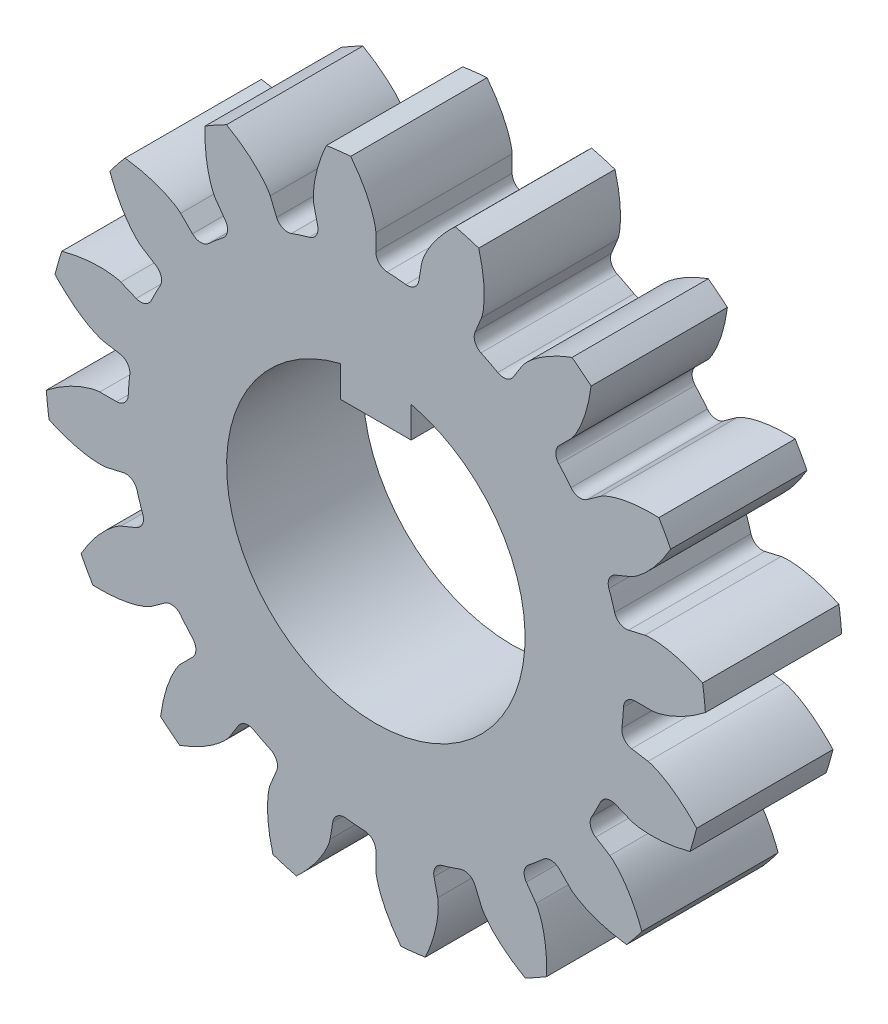
from build123d import *

# Parameters (mm, degrees)
SKETCH1_R                 = 14.0625
BOSS_EXTRUDE1_DEPTH       = 5.8
CUT_EXTRUDE1_DEPTH        = 21.715883097
FILLET1_R                 = 0.5
CIRPATTERN19_COUNT        = 16
FILLET1_OF_CIRPATTERN19_R = 0.5
CUT_EXTRUDE2_DEPTH        = 21.660632656


with BuildPart() as part:
    # Sketch1 → Boss-Extrude1 (new body)
    with BuildSketch(Plane.XY):
        Circle(SKETCH1_R)
    extrude(amount=BOSS_EXTRUDE1_DEPTH)

    # Sketch2 → Cut-Extrude1 (cut, symmetric)
    with BuildSketch(Plane.XY.offset(5.8)):
        with BuildLine():
            Line((11.74615776, 0), (10.546875, 0))
            ThreePointArc((10.546875, 0), (10.510330334, -0.877227761), (10.400949587, -1.748376376))
            Line((10.400949587, -1.748376376), (11.583639201, -1.947183856))
            add(Edge.make_bspline(
                [(11.583639201, -1.947183856), (11.587589537, -1.947906479), (11.598636798, -1.950109213), (11.619390143, -1.954967722), (11.653043024, -1.963876588), (11.695593212, -1.976665304), (11.750177743, -1.994836747), (11.813916551, -2.018345028), (11.88333315, -2.046369626), (11.958132634, -2.079207519), (12.032084113, -2.114033132), (12.105198467, -2.150683237), (12.177420437, -2.188907553), (12.264149408, -2.237221541), (12.367075196, -2.297943399), (12.485735253, -2.372938949), (12.618308241, -2.462709979), (12.751163332, -2.559177154), (12.879998288, -2.658169381), (13.007882145, -2.762795087), (13.129988288, -2.867287029), (13.25434815, -2.980451792), (13.36789046, -3.087271642), (13.490355119, -3.210085536), (13.563860971, -3.285459592), (13.622537428, -3.348356192), (13.650563847, -3.378759078)],
                knots=[0, 0, 0, 0, 0, 0.005376749, 0.015083688, 0.02853182, 0.04661014, 0.064854849, 0.092110525, 0.119476176, 0.146842496, 0.174208854, 0.201574956, 0.228941013, 0.256307345, 0.307035032, 0.361767352, 0.416499661, 0.471231937, 0.525964282, 0.580696616, 0.635428982, 0.690161387, 0.744893688, 0.799626082, 0.851029126, 0.851029126, 0.851029126, 0.851029126, 0.851029126], degree=4))
            ThreePointArc((13.650563847, -3.378759078), (13.959136083, -1.701888973), (14.0625, 0))
            ThreePointArc((14.0625, 0), (14.052321247, 0.534952164), (14.021799724, 1.069129907))
            add(Edge.make_bspline(
                [(11.74615776, 0), (11.750173229, 5.777e-05), (11.761432794, 0.000398701), (11.782704403, 0.001749664), (11.817368506, 0.004956563), (11.861449985, 0.010514708), (11.918291607, 0.019386146), (11.985045546, 0.032003061), (12.058147397, 0.048132586), (12.137355566, 0.068116479), (12.216056972, 0.090201166), (12.294235284, 0.114223872), (12.371794519, 0.139946941), (12.465332623, 0.173215229), (12.576900325, 0.216034734), (12.706350775, 0.270322141), (12.851971018, 0.336874222), (12.998979496, 0.409983036), (13.142442043, 0.486248391), (13.285900523, 0.568226947), (13.423639055, 0.651031372), (13.565037835, 0.742015019), (13.694716924, 0.828534788), (13.835846278, 0.929348233), (13.920830019, 0.99149421), (13.989121129, 1.043793667), (14.021799724, 1.069129907)],
                knots=[0, 0, 0, 0, 0, 0.005376749, 0.015083688, 0.02853182, 0.04661014, 0.064854849, 0.092110525, 0.119476176, 0.146842496, 0.174208854, 0.201574956, 0.228941013, 0.256307345, 0.307035032, 0.361767352, 0.416499661, 0.471231937, 0.525964282, 0.580696616, 0.635428982, 0.690161387, 0.744893688, 0.799626082, 0.851029126, 0.851029126, 0.851029126, 0.851029126, 0.851029126], degree=4))
        make_face()
    cut_extrude1 = extrude(amount=CUT_EXTRUDE1_DEPTH, both=True, mode=Mode.SUBTRACT)

    # Fillet1
    fillet1_edges = [part.edges().sort_by_distance(p)[0] for p in [
        (10.546875, 0, 2.9),
        (10.400949587, -1.748376376, 2.9),
    ]]
    fillet(fillet1_edges, radius=FILLET1_R)

    # CirPattern19: Cut-Extrude1 ×16 about axis
    cirpattern19_axis = Axis((0, 0, 5.8), (0, 0, -1))
    for i in range(1, CIRPATTERN19_COUNT):
        add(cut_extrude1.rotate(cirpattern19_axis, i * 360 / CIRPATTERN19_COUNT), mode=Mode.SUBTRACT)

    # Fillet1 of CirPattern19
    fillet1_of_cirpattern19_edges = [part.edges().sort_by_distance(p)[0] for p in [
        (9.744041944, -4.036114326, 2.9),
        (8.94014977, -5.595560237, 2.9),
        (7.457766833, -7.457766833, 2.9),
        (6.118293192, -8.590870775, 2.9),
        (4.036114326, -9.744041944, 2.9),
        (2.364981939, -10.278299115, 2.9),
        (0, -10.546875, 2.9),
        (-1.748376376, -10.400949587, 2.9),
        (-4.036114326, -9.744041944, 2.9),
        (-5.595560237, -8.94014977, 2.9),
        (-7.457766833, -7.457766833, 2.9),
        (-8.590870775, -6.118293192, 2.9),
        (-9.744041944, -4.036114326, 2.9),
        (-10.278299115, -2.364981939, 2.9),
        (-10.546875, 0, 2.9),
        (-10.400949587, 1.748376376, 2.9),
        (-9.744041944, 4.036114326, 2.9),
        (-8.94014977, 5.595560237, 2.9),
        (-7.457766833, 7.457766833, 2.9),
        (-6.118293192, 8.590870775, 2.9),
        (-4.036114326, 9.744041944, 2.9),
        (-2.364981939, 10.278299115, 2.9),
        (0, 10.546875, 2.9),
        (1.748376376, 10.400949587, 2.9),
        (4.036114326, 9.744041944, 2.9),
        (5.595560237, 8.94014977, 2.9),
        (7.457766833, 7.457766833, 2.9),
        (8.590870775, 6.118293192, 2.9),
        (9.744041944, 4.036114326, 2.9),
        (10.278299115, 2.364981939, 2.9),
    ]]
    fillet(fillet1_of_cirpattern19_edges, radius=FILLET1_OF_CIRPATTERN19_R)

    # Sketch3 → Cut-Extrude2 (cut, through all)
    with BuildSketch(Plane(origin=(0, 0, 0), x_dir=(-1, 0, 0), z_dir=(0, 0, -1))):
        with BuildLine():
            Line((-1.5, 6.170291727), (-1.5, 4.85))
            Line((-1.5, 4.85), (1.5, 4.85))
            Line((1.5, 4.85), (1.5, 6.170291727))
            ThreePointArc((1.5, 6.170291727), (0, -6.35), (-1.5, 6.170291727))
        make_face()
    extrude(amount=-CUT_EXTRUDE2_DEPTH, mode=Mode.SUBTRACT)


solid = part.part
